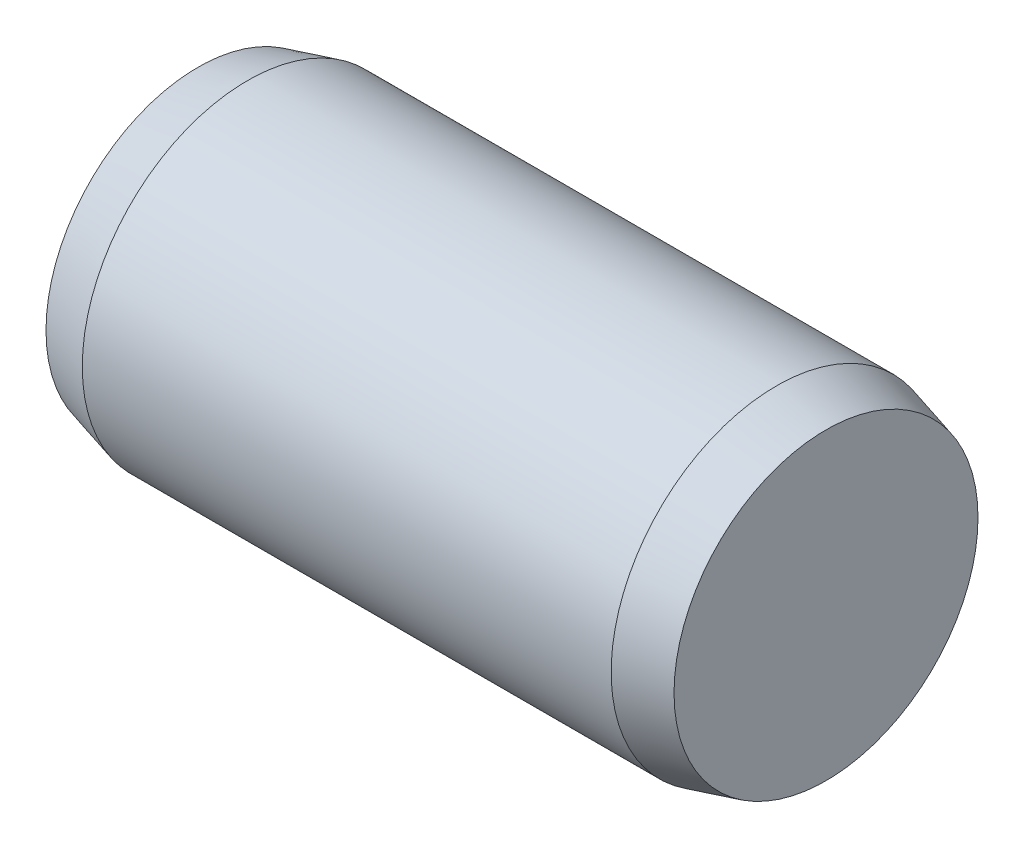
from build123d import *

# Parameters (mm, degrees)
EXTRUDE1_DEPTH      = 4
EXTRUDE1_DEPTH_BACK = 4
SKETCH2_R           = 2.5
SKETCH3_R           = 2.5
EXTRUDE2_DEPTH      = 0.75
EXTRUDE2_TAPER      = 15
SKETCH4_R           = 2.5
EXTRUDE3_DEPTH      = 0.75
EXTRUDE3_TAPER      = 15


with BuildPart() as part:
    # Sketch2 → Extrude1 (new, two sides: drawn at the far end of the back side and taken through both)
    with BuildSketch(Plane(origin=(0, 0, 0), x_dir=(0, 0, -1), z_dir=(1, 0, 0)).offset(-EXTRUDE1_DEPTH_BACK)):
        Circle(SKETCH2_R)
    extrude(amount=EXTRUDE1_DEPTH + EXTRUDE1_DEPTH_BACK)

    # Sketch3 → Extrude2 (add)
    with BuildSketch(Plane(origin=(4, 0, 0), x_dir=(0, 0, -1), z_dir=(1, 0, 0))):
        Circle(SKETCH3_R)
    extrude(amount=EXTRUDE2_DEPTH, taper=EXTRUDE2_TAPER)

    # Sketch4 → Extrude3 (add)
    with BuildSketch(Plane.ZY.offset(4)):
        with Locations(Location((0, 0, 0), (0, 0, 180))):
            Circle(SKETCH4_R)
    extrude(amount=EXTRUDE3_DEPTH, taper=EXTRUDE3_TAPER)


solid = part.part
